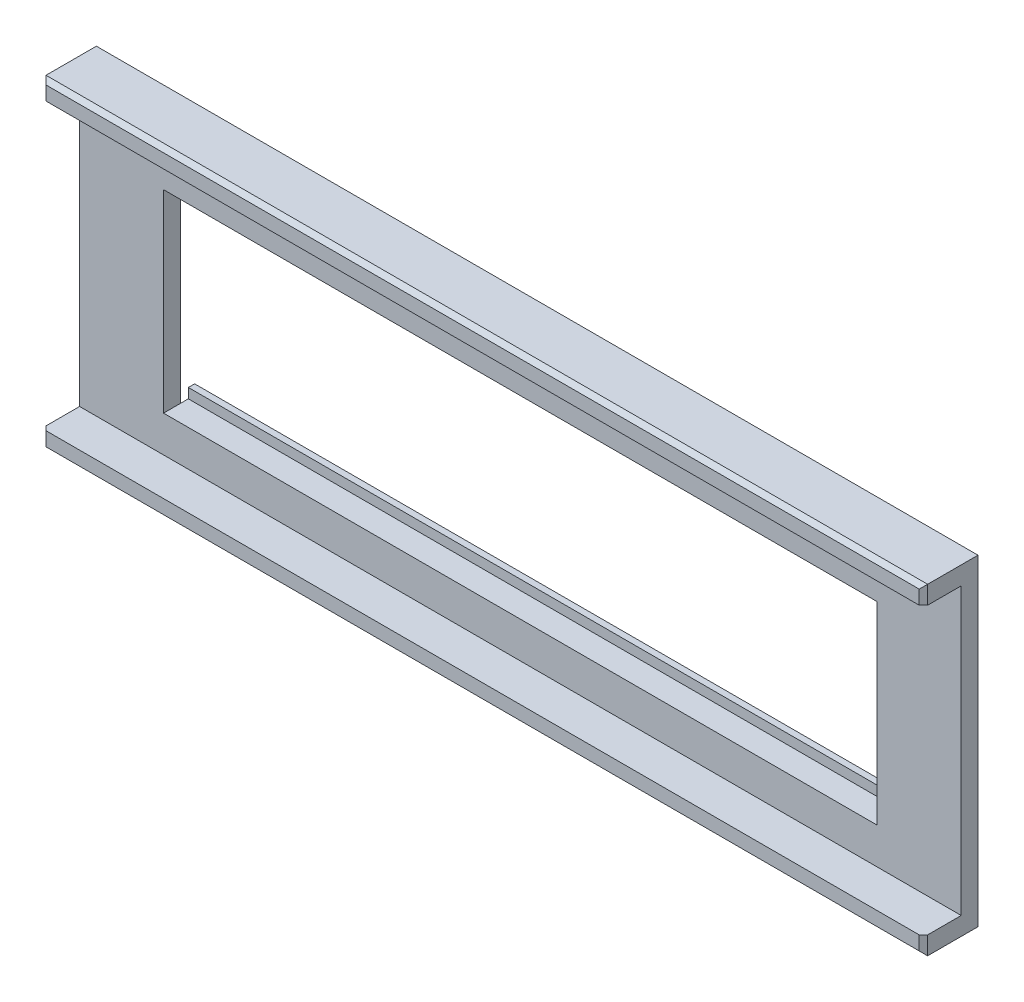
from build123d import *

# Parameters (mm, degrees)
SKETCH_1_W          = 210
SKETCH_1_H          = 76.65
SKETCH_1_W_2        = 170
SKETCH_1_H_2        = 46.1
EXTRUDE_1_DEPTH     = 13
SKETCH_2_W          = 210
SKETCH_2_H          = 68
CUT_EXTRUDE_1_DEPTH = 9
CHAMFER_1_SIZE      = 1
EXTRUDE_2_DEPTH     = 210
SKETCH_7_W          = 20
SKETCH_7_H          = 76.65
CUT_EXTRUDE_2_DEPTH = 4.9


with BuildPart() as part:
    # 草图1 → 凸台-拉伸1 (new body)
    with BuildSketch(Plane.XY):
        Rectangle(SKETCH_1_W, SKETCH_1_H)
        with Locations((0, -2.325)):
            Rectangle(SKETCH_1_W_2, SKETCH_1_H_2, mode=Mode.SUBTRACT)
    extrude(amount=EXTRUDE_1_DEPTH)

    # 草图2 → 切除-拉伸1 (cut)
    with BuildSketch(Plane.XY.offset(13)):
        Rectangle(SKETCH_2_W, SKETCH_2_H)
    extrude(amount=-CUT_EXTRUDE_1_DEPTH, mode=Mode.SUBTRACT)

    # 倒角1
    chamfer_1_edges = [part.edges().sort_by_distance(p)[0] for p in [
        (105, -36.1625, 13),
        (0, 38.325, 13),
        (105, 36.1625, 13),
        (-105, -36.1625, 13),
        (-105, 36.1625, 13),
        (0, -38.325, 13),
    ]]
    chamfer(chamfer_1_edges, length=CHAMFER_1_SIZE)

    # 草图6 → 凸台-拉伸2 (add)
    with BuildSketch(Plane(origin=(105, 0, 0), x_dir=(0, 0, -1), z_dir=(1, 0, 0))):
        Polygon((0, 20.725), (0, 26.625), (1.9, 26.625), (1.9, 28.975), (3.4, 28.975), (4.9, 27.475), (4.9, 19.875), (3.4, 18.375), (1.9, 18.375), (1.9, 20.725), align=None)
        Polygon((0, -31.275), (0, -25.375), (1.9, -25.375), (1.9, -23.025), (3.4, -23.025), (4.9, -24.525), (4.9, -32.125), (3.4, -33.625), (1.9, -33.625), (1.9, -31.275), align=None)
    extrude(amount=-EXTRUDE_2_DEPTH)

    # 草图7 → 切除-拉伸2 (cut)
    with BuildSketch(Plane(origin=(0, 0, -4.9), x_dir=(-1, 0, 0), z_dir=(0, 0, -1))):
        with Locations((-95, 0)):
            Rectangle(SKETCH_7_W, SKETCH_7_H)
        with Locations((95, 0)):
            Rectangle(SKETCH_7_W, SKETCH_7_H)
    extrude(amount=-CUT_EXTRUDE_2_DEPTH, mode=Mode.SUBTRACT)


solid = part.part
